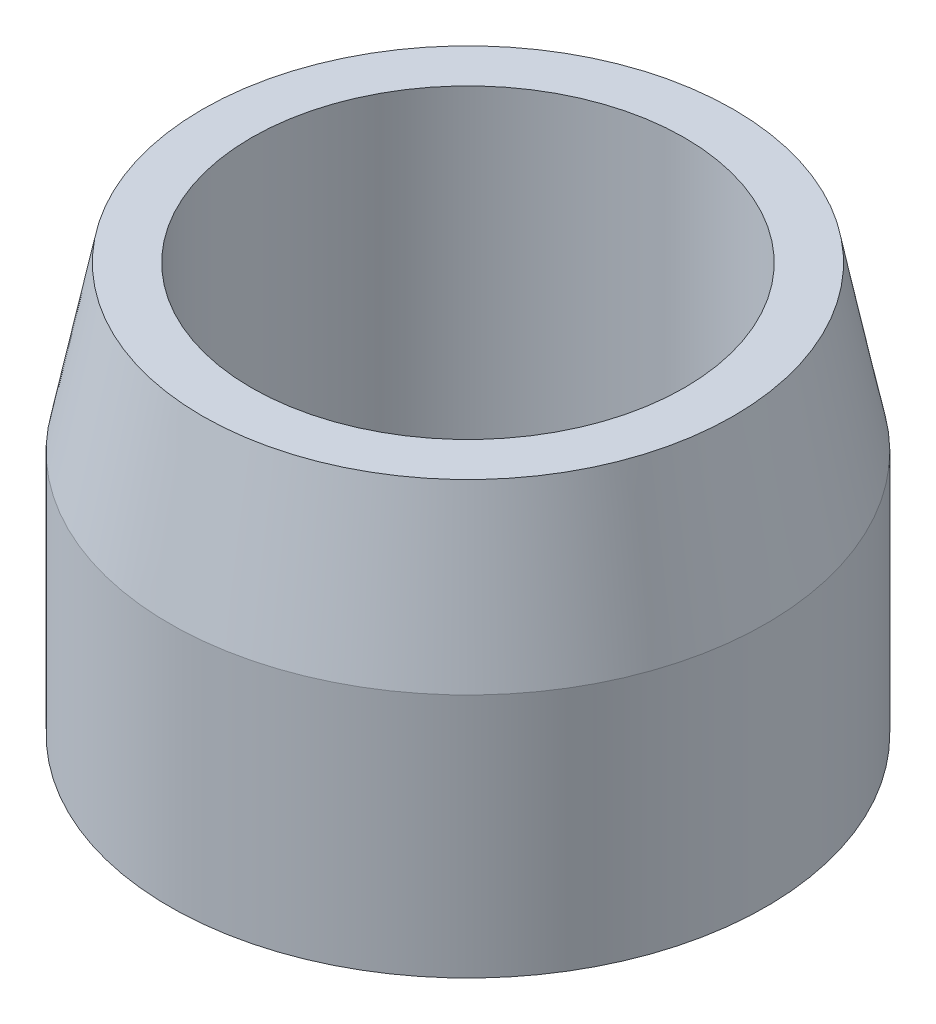
from build123d import *


with BuildPart() as part:
    # 草图1 → 旋转1 (revolve)
    with BuildSketch(Plane.XY, mode=Mode.PRIVATE) as revolve_1_sk:
        Polygon((2.65, 0), (2.65, 5), (3.25, 5), (3.65, 3), (3.65, 0), align=None)
    revolve(revolve_1_sk.sketch.rotate(Axis((0, 0, 0), (0, 1, 0)), 90), axis=Axis((0, 0, 0), (0, 1, 0)))


solid = part.part
